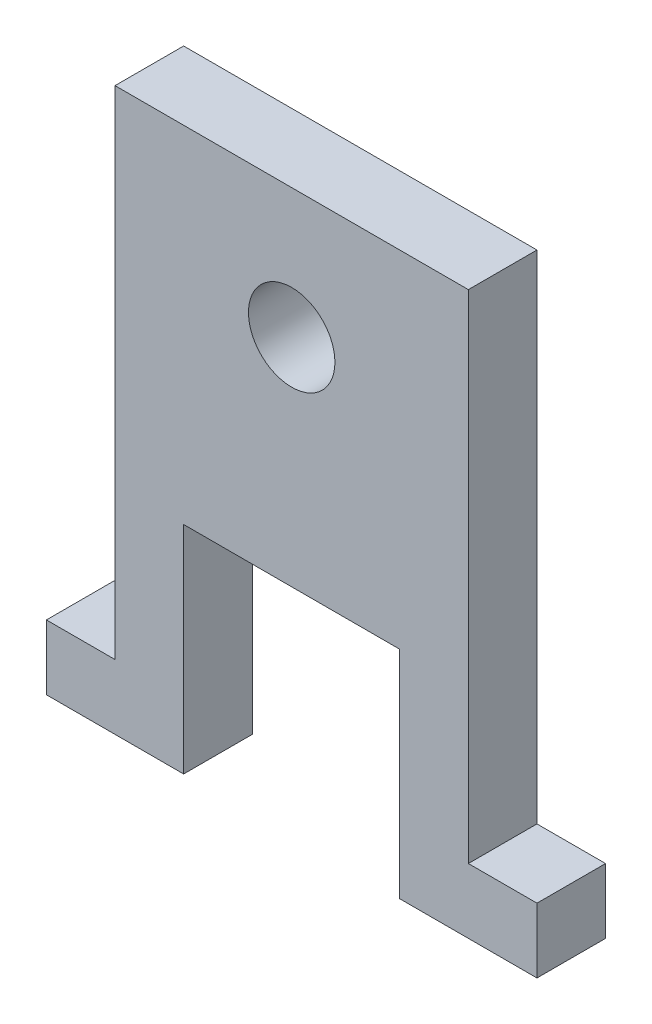
from build123d import *

# Parameters (mm, degrees)
SKETCH1_R           = 4
BOSS_EXTRUDE1_DEPTH = 6.35


with BuildPart() as part:
    # Sketch1 → Boss-Extrude1 (new body)
    with BuildSketch(Plane.XY):
        Polygon((-10, -8.2), (-10, 11.8), (10, 11.8), (10, -8.2), (22.7, -8.2), (22.7, -2.2), (16.35, -2.2), (16.35, 43.8), (-16.35, 43.8), (-16.35, -2.2), (-22.7, -2.2), (-22.7, -8.2), align=None)
        with Locations((0, 31.8)):
            Circle(SKETCH1_R, mode=Mode.SUBTRACT)
    extrude(amount=BOSS_EXTRUDE1_DEPTH)


solid = part.part
